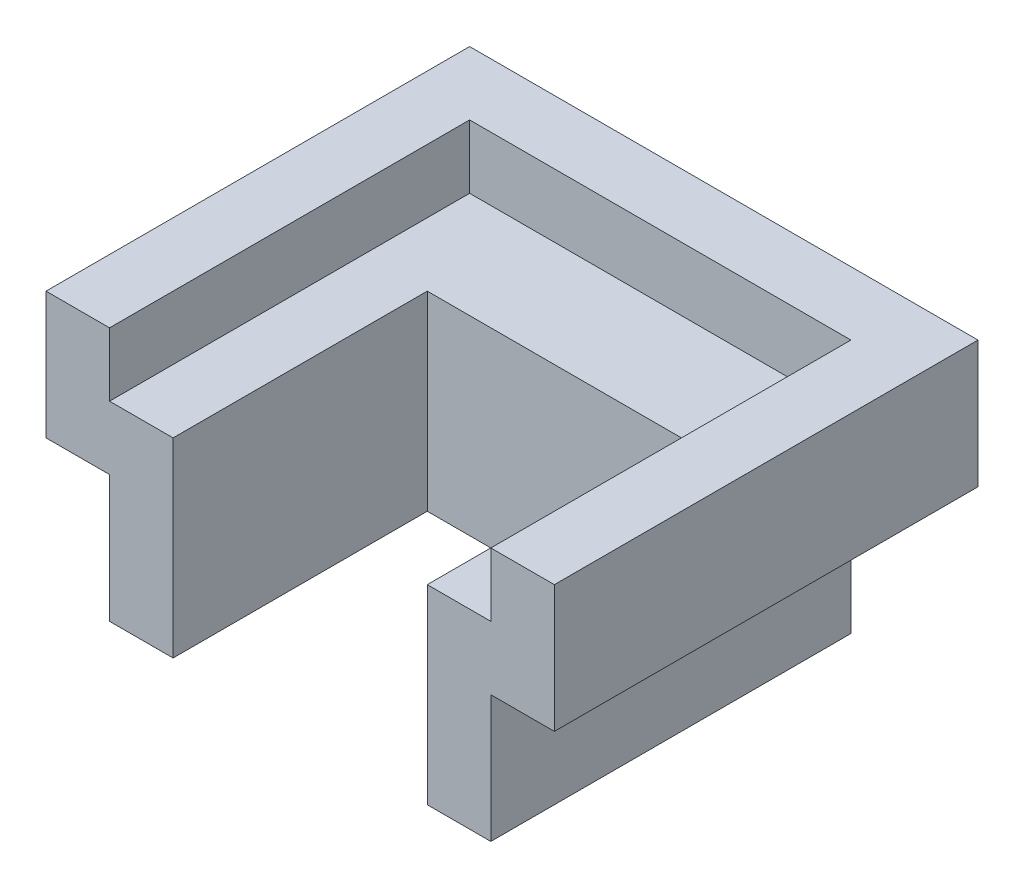
from build123d import *

# Parameters (mm, degrees)
BOSS_EXTRUDE1_DEPTH = 9.525
BOSS_EXTRUDE2_DEPTH = 28.575


with BuildPart() as part:
    # Sketch1 → Boss-Extrude1 (new, symmetric)
    with BuildSketch(Plane(origin=(0, 0, 0), x_dir=(1, 0, 0), z_dir=(0, 1, 0))):
        Polygon((38.1, 0), (-38.1, 0), (-38.1, -63.5), (-28.575, -63.5), (-28.575, -9.525), (28.575, -9.525), (28.575, -63.5), (38.1, -63.5), align=None)
    extrude(amount=BOSS_EXTRUDE1_DEPTH, both=True)

    # Sketch1<3> → Boss-Extrude2 (add)
    with BuildSketch(Plane(origin=(0, 0, 0), x_dir=(1, 0, 0), z_dir=(0, 1, 0))):
        Polygon((-28.575, -9.525), (-28.575, -63.5), (-19.05, -63.5), (-19.05, -25.4), (19.05, -25.4), (19.05, -63.5), (28.575, -63.5), (28.575, -9.525), align=None)
    extrude(amount=-BOSS_EXTRUDE2_DEPTH)


solid = part.part
